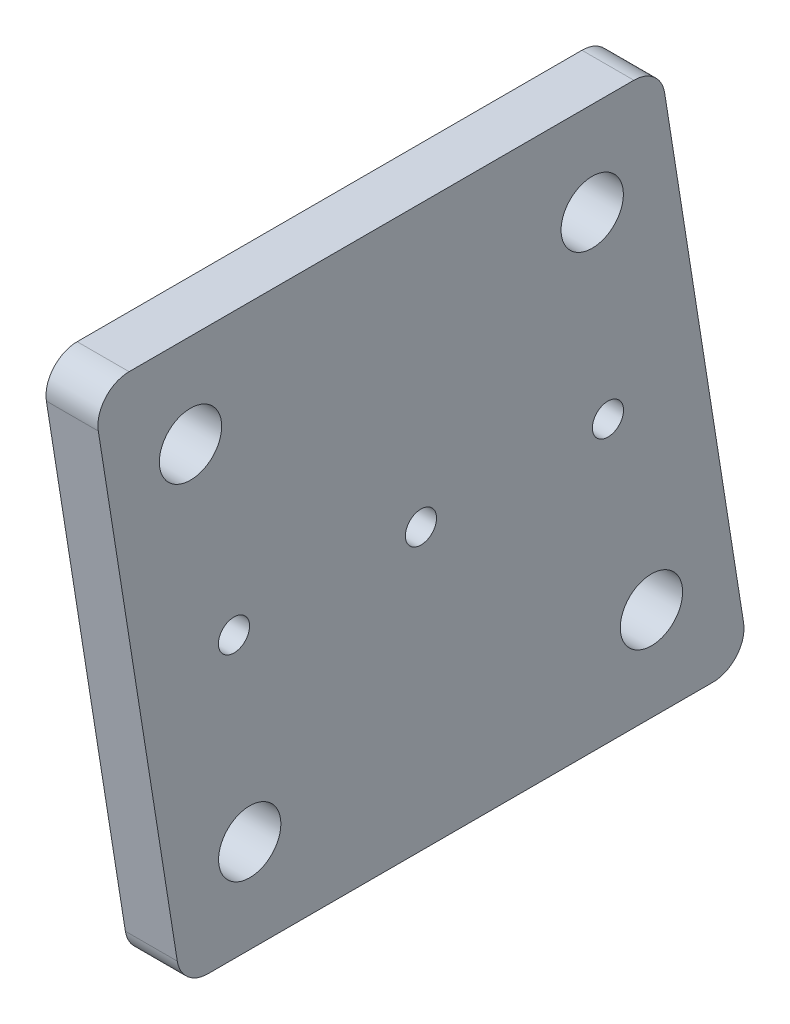
from build123d import *

# Parameters (mm, degrees)
SKETCH1_R           = 3
SKETCH1_R_2         = 1.5
BOSS_EXTRUDE1_DEPTH = 5
FILLET1_R           = 3


with BuildPart() as part:
    # Sketch1 → Boss-Extrude1 (new body)
    with BuildSketch(Plane(origin=(0, 0, 0), x_dir=(0, 0, -1), z_dir=(1, 0, 0))):
        Polygon((-6.573014531, -9), (48.100102262, -9), (39.547342484, 45), (-15.125774308, 45), align=None)
        Circle(SKETCH1_R, mode=Mode.SUBTRACT)
        with Locations((38.676167805, 0)):
            Circle(SKETCH1_R, mode=Mode.SUBTRACT)
        with Locations((-5.701839852, 36)):
            Circle(SKETCH1_R, mode=Mode.SUBTRACT)
        with Locations((32.974327953, 36)):
            Circle(SKETCH1_R, mode=Mode.SUBTRACT)
        with Locations((16.487163977, 18)):
            Circle(SKETCH1_R_2, mode=Mode.SUBTRACT)
        with Locations((-1.512836023, 18)):
            Circle(SKETCH1_R_2, mode=Mode.SUBTRACT)
        with Locations((34.487163977, 18)):
            Circle(SKETCH1_R_2, mode=Mode.SUBTRACT)
    extrude(amount=BOSS_EXTRUDE1_DEPTH)

    # Fillet1
    fillet1_edges = [part.edges().sort_by_distance(p)[0] for p in [
        (2.5, 45, 15.125774308),
        (2.5, 45, -39.547342484),
        (2.5, -9, -48.100102262),
        (2.5, -9, 6.573014531),
    ]]
    fillet(fillet1_edges, radius=FILLET1_R)


solid = part.part
